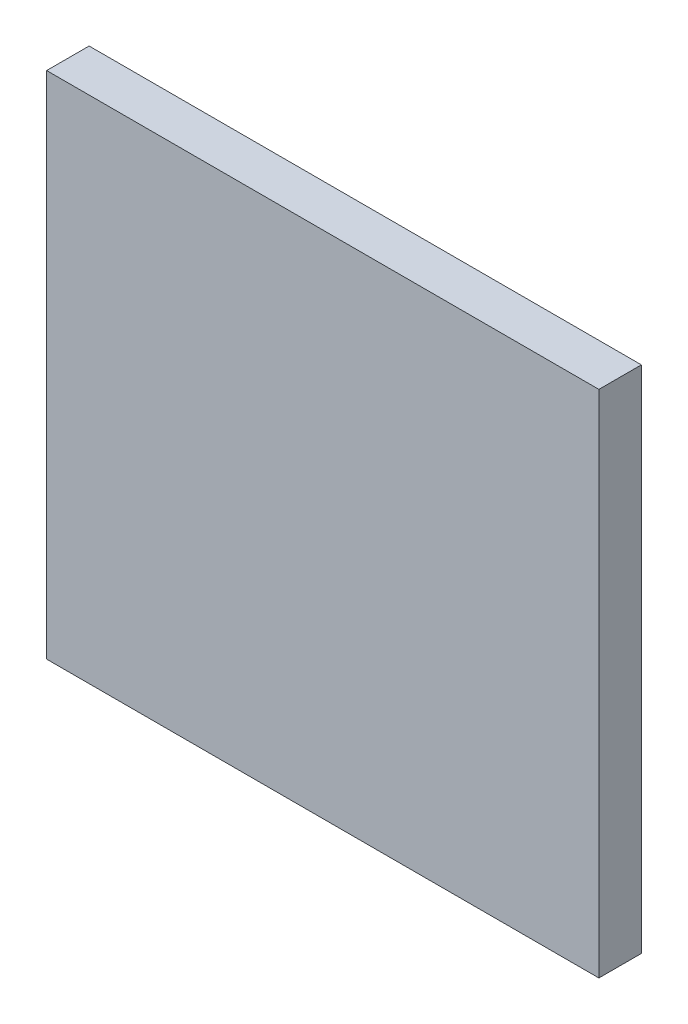
from build123d import *

# Parameters (mm, degrees)
SKETCH1_W           = 65
SKETCH1_H           = 60
BOSS_EXTRUDE1_DEPTH = 5


with BuildPart() as part:
    # Sketch1 → Boss-Extrude1 (new body)
    with BuildSketch(Plane.XY):
        with Locations((-26.680327869, 6.229508197)):
            Rectangle(SKETCH1_W, SKETCH1_H)
    extrude(amount=BOSS_EXTRUDE1_DEPTH)


solid = part.part
